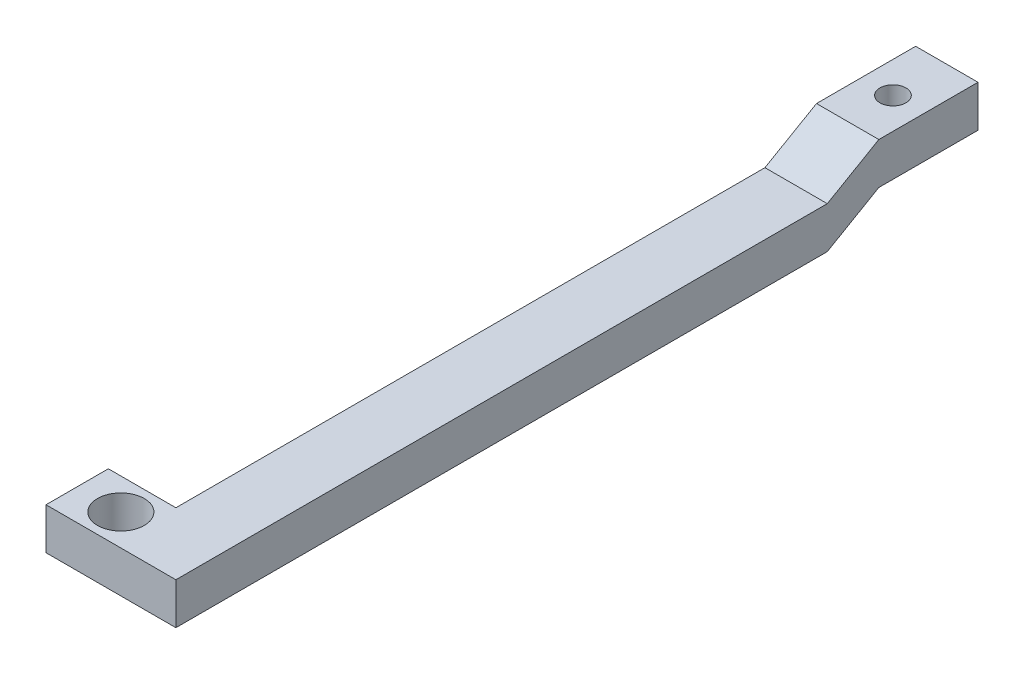
from build123d import *

# Parameters (mm, degrees)
BOSS_EXTRUDE1_DEPTH = 12
SKETCH1_3_W         = 12
SKETCH1_3_H         = 8
BOSS_EXTRUDE2_DEPTH = 25
SKETCH2_R           = 4.5
CUT_EXTRUDE1_DEPTH  = 8
SKETCH4_R           = 2.5
CUT_EXTRUDE2_DEPTH  = 8


with BuildPart() as part:
    # Sketch1 → Boss-Extrude1 (new body)
    with BuildSketch(Plane(origin=(0, 0, 0), x_dir=(0, 0, -1), z_dir=(1, 0, 0))):
        Polygon((0, 0), (125.37946203, 0), (135.304113157, 5.73), (154.39, 5.73), (154.39, 13.73), (135.304113157, 13.73), (125.37946203, 8), (0, 8), align=None)
    extrude(amount=-BOSS_EXTRUDE1_DEPTH)

    # Sketch1<3> → Boss-Extrude2 (add)
    with BuildSketch(Plane(origin=(0, 0, 0), x_dir=(0, 0, -1), z_dir=(1, 0, 0))):
        with Locations((6, 4)):
            Rectangle(SKETCH1_3_W, SKETCH1_3_H)
    extrude(amount=-BOSS_EXTRUDE2_DEPTH)

    # Sketch2 → Cut-Extrude1 (cut)
    with BuildSketch(Plane(origin=(0, 8, 0), x_dir=(1, 0, 0), z_dir=(0, 1, 0))):
        with Locations(Location((-16.59, 6, 0), (0, 0, 270))):
            Circle(SKETCH2_R)
    extrude(amount=-CUT_EXTRUDE1_DEPTH, mode=Mode.SUBTRACT)

    # Sketch4 → Cut-Extrude2 (cut)
    with BuildSketch(Plane(origin=(0, 13.73, 0), x_dir=(1, 0, 0), z_dir=(0, 1, 0))):
        with Locations(Location((-6, 144.02, 0), (0, 0, 270))):
            Circle(SKETCH4_R)
    extrude(amount=-CUT_EXTRUDE2_DEPTH, mode=Mode.SUBTRACT)


solid = part.part
